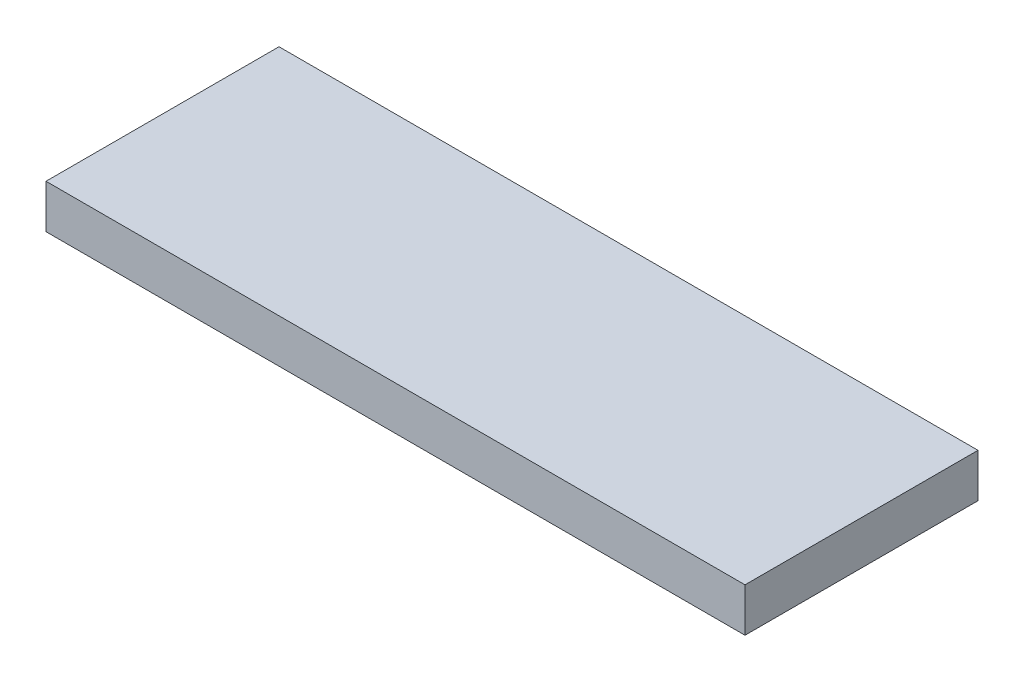
from build123d import *

# Parameters (mm, degrees)
SKETCH2_W           = 96
SKETCH2_H           = 32
BOSS_EXTRUDE1_DEPTH = 6


with BuildPart() as part:
    # Sketch2 → Boss-Extrude1 (new body)
    with BuildSketch(Plane(origin=(0, 0, 0), x_dir=(1, 0, 0), z_dir=(0, 1, 0))):
        Rectangle(SKETCH2_W, SKETCH2_H)
    extrude(amount=BOSS_EXTRUDE1_DEPTH)


solid = part.part
